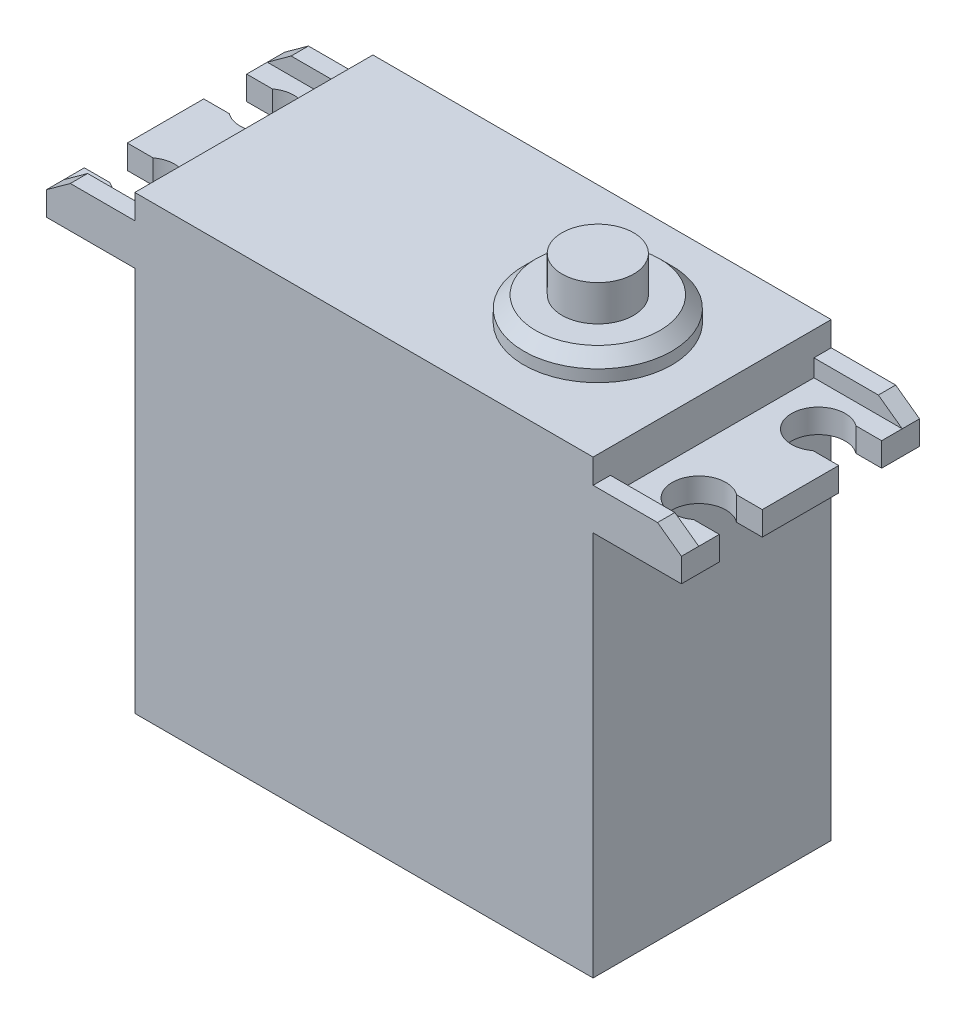
from build123d import *

# Parameters (mm, degrees)
EXTRUDE_1_DEPTH     = 19.95
SKETCH_2_W          = 7.4
SKETCH_2_H          = 1.45
EXTRUDE_2_DEPTH     = 1.45
CHAMFER_1_SIZE      = 1.45
CHAMFER_1_SIZE2     = 2
CHAMFER_3_SIZE      = 1.45
CHAMFER_3_SIZE2     = 2
CHAMFER_4_SIZE      = 1.45
CHAMFER_4_SIZE2     = 2
CHAMFER_5_SIZE      = 1.45
CHAMFER_5_SIZE2     = 2
SKETCH_3_R          = 2.25
CUT_EXTRUDE_1_DEPTH = 2
SKETCH_4_W          = 2.602143293
SKETCH_4_H          = 3.6
SKETCH_4_W_2        = 2.852203288
CUT_EXTRUDE_2_DEPTH = 2
SKETCH_5_R          = 6.2
EXTRUDE_3_DEPTH     = 2
CHAMFER_6_SIZE      = 1
SKETCH_6_R          = 3
EXTRUDE_4_DEPTH     = 3


with BuildPart() as part:
    # 草圖1 → 填料-伸長1 (new body)
    with BuildSketch(Plane.XY):
        Polygon((-14.470198675, -11.825165563), (-14.470198675, -44.125165563), (23.929801325, -44.125165563), (23.929801325, -11.825165563), (31.329801325, -11.825165563), (31.329801325, -9.825165563), (23.929801325, -9.825165563), (23.929801325, -6.325165563), (-14.470198675, -6.325165563), (-14.470198675, -9.825165563), (-21.870198675, -9.825165563), (-21.870198675, -11.825165563), align=None)
    extrude(amount=EXTRUDE_1_DEPTH)

    # 草圖2 → 填料-伸長2 (add)
    with BuildSketch(Plane(origin=(0, -9.825165563, 0), x_dir=(1, 0, 0), z_dir=(0, 1, 0))):
        with Locations((27.629801325, -0.725)):
            Rectangle(SKETCH_2_W, SKETCH_2_H)
        with Locations((27.629801325, -19.225)):
            Rectangle(SKETCH_2_W, SKETCH_2_H)
        with Locations((-18.170198675, -0.725)):
            Rectangle(SKETCH_2_W, SKETCH_2_H)
        with Locations((-18.170198675, -19.225)):
            Rectangle(SKETCH_2_W, SKETCH_2_H)
    extrude(amount=EXTRUDE_2_DEPTH)

    # 導角1
    chamfer_1_edges = [part.edges().sort_by_distance(p)[0] for p in [
        (31.329801325, -8.375165563, 19.225),
    ]]
    chamfer_1_side = [part.faces().sort_by_distance(p)[0] for p in [
        (31.329801325, -10.660702917, 9.975),
    ]]
    chamfer(chamfer_1_edges, length=CHAMFER_1_SIZE, length2=CHAMFER_1_SIZE2, reference=chamfer_1_side[0])

    # 導角3
    chamfer_3_edges = [part.edges().sort_by_distance(p)[0] for p in [
        (31.329801325, -8.375165563, 0.725),
    ]]
    chamfer_3_side = [part.faces().sort_by_distance(p)[0] for p in [
        (31.329801325, -10.738818024, 9.511976966),
    ]]
    chamfer(chamfer_3_edges, length=CHAMFER_3_SIZE, length2=CHAMFER_3_SIZE2, reference=chamfer_3_side[0])

    # 導角4
    chamfer_4_edges = [part.edges().sort_by_distance(p)[0] for p in [
        (-21.870198675, -8.375165563, 19.225),
    ]]
    chamfer_4_side = [part.faces().sort_by_distance(p)[0] for p in [
        (-21.870198675, -10.660702917, 9.975),
    ]]
    chamfer(chamfer_4_edges, length=CHAMFER_4_SIZE, length2=CHAMFER_4_SIZE2, reference=chamfer_4_side[0])

    # 導角5
    chamfer_5_edges = [part.edges().sort_by_distance(p)[0] for p in [
        (-21.870198675, -8.375165563, 0.725),
    ]]
    chamfer_5_side = [part.faces().sort_by_distance(p)[0] for p in [
        (-21.870198675, -10.738818024, 9.511976966),
    ]]
    chamfer(chamfer_5_edges, length=CHAMFER_5_SIZE, length2=CHAMFER_5_SIZE2, reference=chamfer_5_side[0])

    # 草圖3 → 除料-伸長1 (cut)
    with BuildSketch(Plane(origin=(0, -9.825165563, 0), x_dir=(1, 0, 0), z_dir=(0, 1, 0))):
        with Locations(Location((-18.370198675, -4.975, 0), (0, 0, 180))):
            Circle(SKETCH_3_R)
        with Locations(Location((-18.370198675, -14.975, 0), (0, 0, 180))):
            Circle(SKETCH_3_R)
        with Locations(Location((27.829801325, -14.975, 0), (0, 0, 180))):
            Circle(SKETCH_3_R)
        with Locations(Location((27.829801325, -4.975, 0), (0, 0, 180))):
            Circle(SKETCH_3_R)
    extrude(amount=-CUT_EXTRUDE_1_DEPTH, mode=Mode.SUBTRACT)

    # 草圖4 → 除料-伸長2 (cut)
    with BuildSketch(Plane(origin=(0, -9.825165563, 0), x_dir=(1, 0, 0), z_dir=(0, 1, 0))):
        with Locations((-20.569127028, -14.975)):
            Rectangle(SKETCH_4_W, SKETCH_4_H)
        with Locations((-20.569127028, -4.975)):
            Rectangle(SKETCH_4_W, SKETCH_4_H)
        with Locations((29.903699681, -14.975)):
            Rectangle(SKETCH_4_W_2, SKETCH_4_H)
        with Locations((29.903699681, -4.975)):
            Rectangle(SKETCH_4_W_2, SKETCH_4_H)
    extrude(amount=-CUT_EXTRUDE_2_DEPTH, mode=Mode.SUBTRACT)

    # 草圖5 → 填料-伸長3 (add)
    with BuildSketch(Plane(origin=(0, -6.325165563, 0), x_dir=(1, 0, 0), z_dir=(0, 1, 0))):
        with Locations((14.349801325, -9.975)):
            Circle(SKETCH_5_R)
    extrude(amount=EXTRUDE_3_DEPTH)

    # 導角6
    chamfer_6_edges = [part.edges().sort_by_distance(p)[0] for p in [
        (8.149801325, -4.325165563, 9.975),
    ]]
    chamfer(chamfer_6_edges, length=CHAMFER_6_SIZE)

    # 草圖6 → 填料-伸長4 (add)
    with BuildSketch(Plane(origin=(0, -4.325165563, 0), x_dir=(1, 0, 0), z_dir=(0, 1, 0))):
        with Locations(Location((14.349801325, -9.975, 0), (0, 0, 180))):
            Circle(SKETCH_6_R)
    extrude(amount=EXTRUDE_4_DEPTH)


solid = part.part
